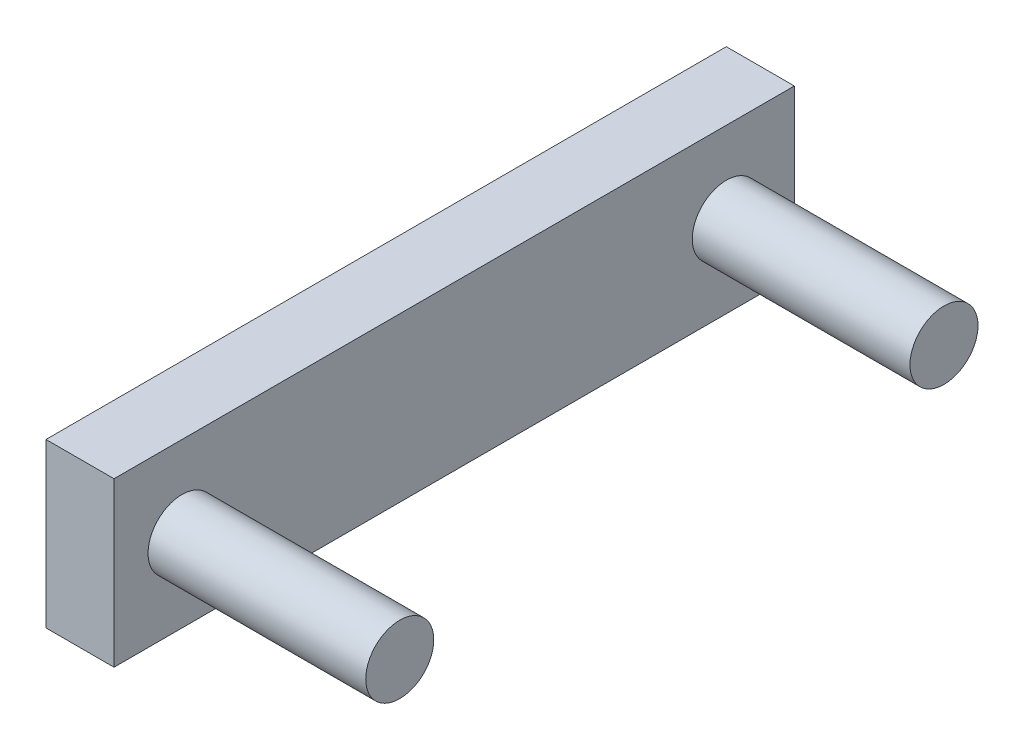
from build123d import *

# Parameters (mm, degrees)
SKETCH_1_W      = 5
SKETCH_1_H      = 50
EXTRUDE_1_DEPTH = 12
SKETCH_2_R      = 2.5
EXTRUDE_2_DEPTH = 16


with BuildPart() as part:
    # 草图1 → 凸台-拉伸1 (new body)
    with BuildSketch(Plane(origin=(0, 0, 0), x_dir=(1, 0, 0), z_dir=(0, 1, 0))):
        with Locations((2.5, 0)):
            Rectangle(SKETCH_1_W, SKETCH_1_H)
    extrude(amount=EXTRUDE_1_DEPTH)

    # 草图2 → 凸台-拉伸2 (add)
    with BuildSketch(Plane(origin=(5, 0, 0), x_dir=(0, 0, -1), z_dir=(1, 0, 0))):
        with Locations(Location((20, 6, 0), (0, 0, 180))):
            Circle(SKETCH_2_R)
        with Locations(Location((-20, 6, 0), (0, 0, 180))):
            Circle(SKETCH_2_R)
    extrude(amount=EXTRUDE_2_DEPTH)


solid = part.part
